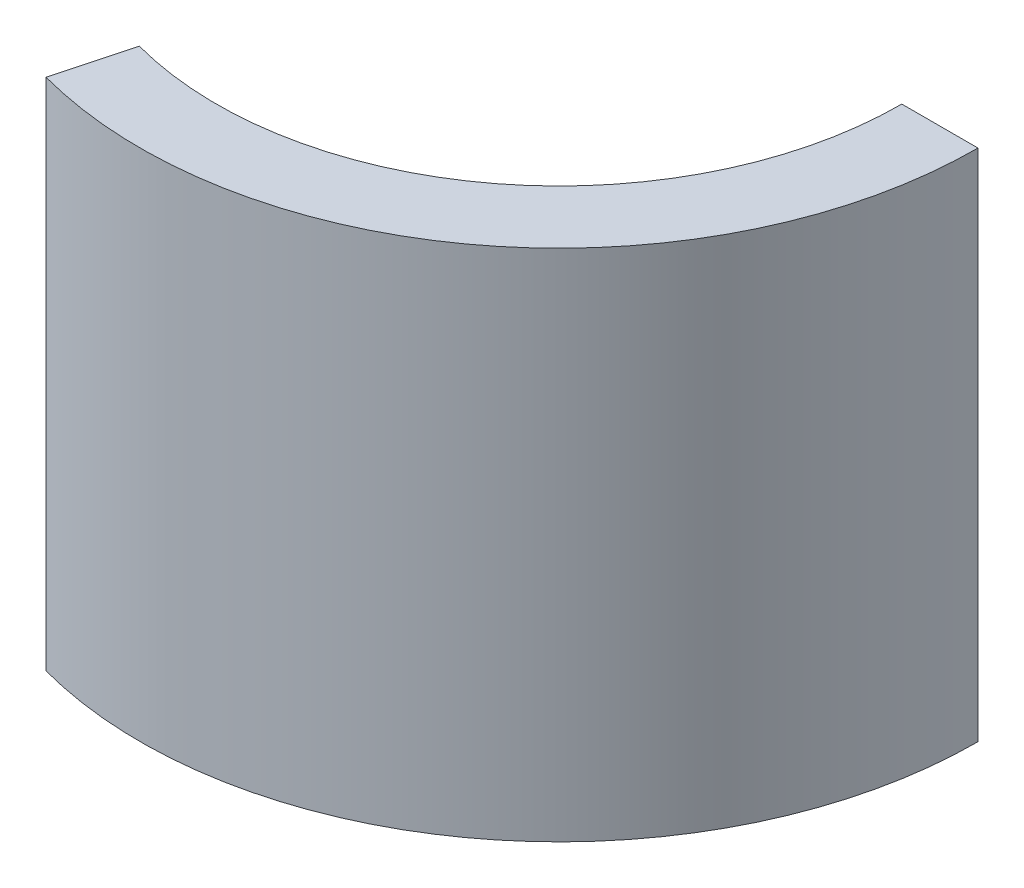
from build123d import *

# Parameters (mm, degrees)
BOSS_EXTRUDE1_DEPTH = 27


with BuildPart() as part:
    # Sketch1 → Boss-Extrude1 (new body)
    with BuildSketch(Plane(origin=(0, 0, 0), x_dir=(1, 0, 0), z_dir=(0, 1, 0))):
        with BuildLine():
            Line((18, 0), (22, 0))
            ThreePointArc((22, 0), (13.392751438, -17.453773486), (-5.694018992, -21.250368178))
            Line((-5.694018992, -21.250368178), (-4.658742812, -17.386664873))
            ThreePointArc((-4.658742812, -17.386664873), (10.957705722, -14.280360125), (18, 0))
        make_face()
    extrude(amount=BOSS_EXTRUDE1_DEPTH)


solid = part.part
